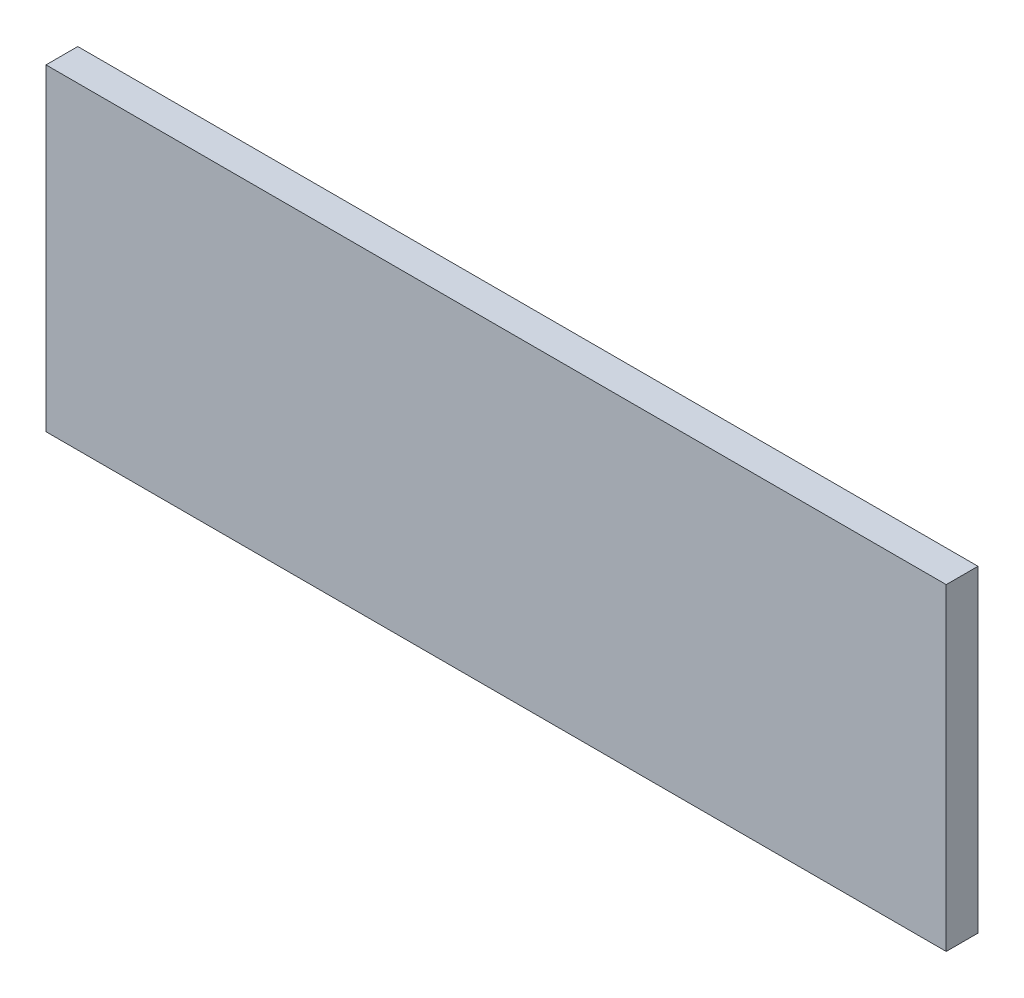
from build123d import *

# Parameters (mm, degrees)
SKETCH1_W           = 170
SKETCH1_H           = 60
BOSS_EXTRUDE1_DEPTH = 6


with BuildPart() as part:
    # Sketch1 → Boss-Extrude1 (new body)
    with BuildSketch(Plane.XY):
        with Locations((85, 30)):
            Rectangle(SKETCH1_W, SKETCH1_H)
    extrude(amount=BOSS_EXTRUDE1_DEPTH)


solid = part.part
